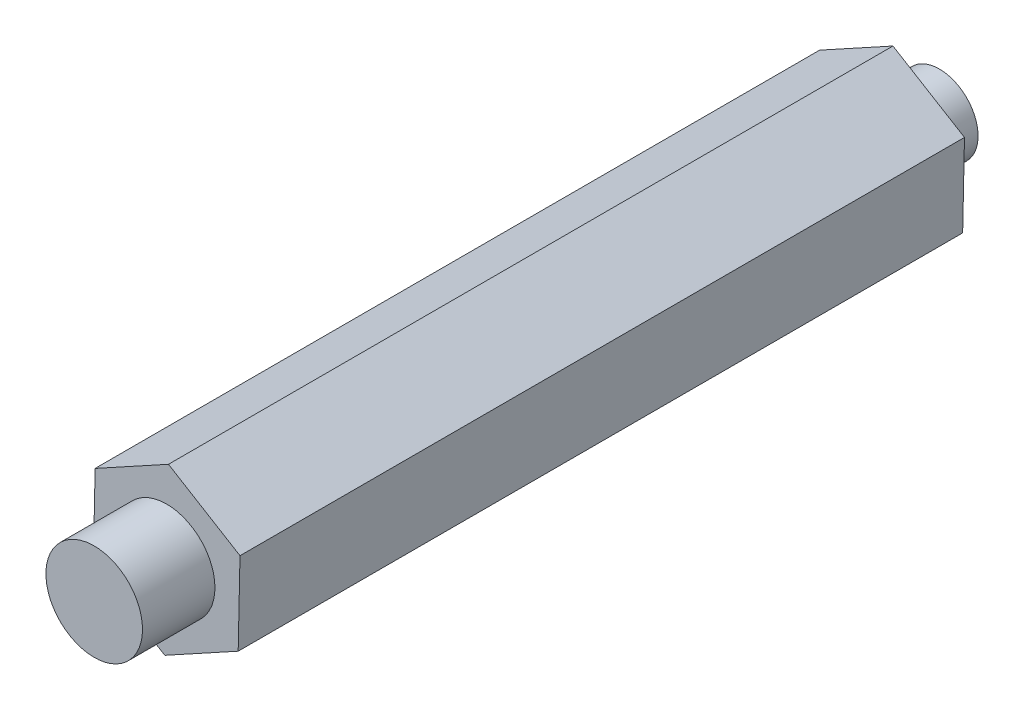
from build123d import *

# Parameters (mm, degrees)
BOSS_EXTRUDE1_DEPTH = 30
SKETCH2_R           = 2
BOSS_EXTRUDE2_DEPTH = 3
SKETCH3_R           = 1.6
BOSS_EXTRUDE3_DEPTH = 2


with BuildPart() as part:
    # Sketch1 → Boss-Extrude1 (new body)
    with BuildSketch(Plane.XY):
        Polygon((2.961597897, -1.796924567), (3.036981272, 1.666356731), (0.075383375, 3.463281298), (-2.961597897, 1.796924567), (-3.036981272, -1.666356731), (-0.075383375, -3.463281298), align=None)
    extrude(amount=BOSS_EXTRUDE1_DEPTH)

    # Sketch2 → Boss-Extrude2 (add)
    with BuildSketch(Plane.XY.offset(30)):
        Circle(SKETCH2_R)
    extrude(amount=BOSS_EXTRUDE2_DEPTH)

    # Sketch3 → Boss-Extrude3 (add)
    with BuildSketch(Plane(origin=(0, 0, 0), x_dir=(-1, 0, 0), z_dir=(0, 0, -1))):
        Circle(SKETCH3_R)
    extrude(amount=BOSS_EXTRUDE3_DEPTH)


solid = part.part
